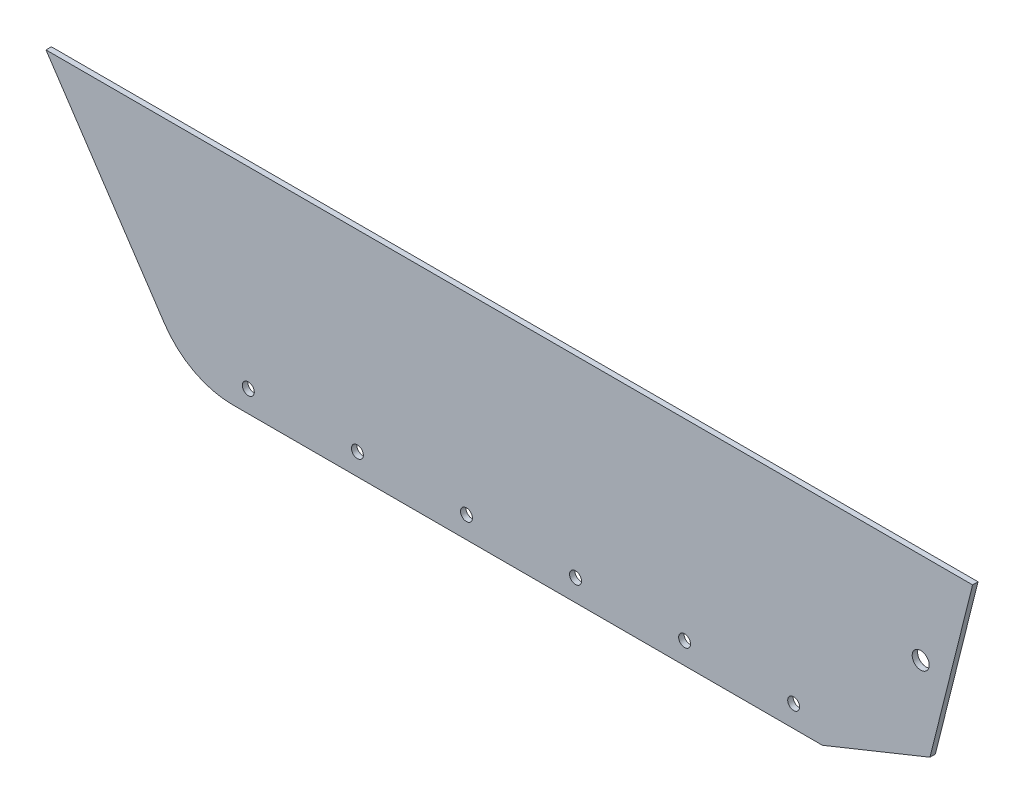
from build123d import *

# Parameters (mm, degrees)
BOSS_EXTRUDE1_DEPTH = 3.175
SKETCH1_4_R         = 3.5
CUT_EXTRUDE1_DEPTH  = 439.905857431
FILLET1_R           = 48
CUT_EXTRUDE3_DEPTH  = 10
CUT_EXTRUDE5_REACH  = 440.906
SKETCH11_R          = 5


with BuildPart() as part:
    # Sketch1 → Boss-Extrude1 (new body)
    with BuildSketch(Plane.XY):
        Polygon((-98.879411765, 3.850980392), (-31.879411765, -96.649019608), (366, -96.649019608), (403.120588235, -71.149019608), (428.120588235, 28.939617947), (-115.605170134, 28.939617947), align=None)
    extrude(amount=BOSS_EXTRUDE1_DEPTH)

    # Sketch1<4> → Cut-Extrude1 (cut, through all)
    with BuildSketch(Plane.XY):
        with Locations((3.120588235, -83.899019608)):
            Circle(SKETCH1_4_R)
        with Locations((67.120588235, -83.899019608)):
            Circle(SKETCH1_4_R)
        with Locations((131.120588235, -83.899019608)):
            Circle(SKETCH1_4_R)
        with Locations((195.120588235, -83.899019608)):
            Circle(SKETCH1_4_R)
        with Locations((259.120588235, -83.899019608)):
            Circle(SKETCH1_4_R)
        with Locations((323.120588235, -83.899019608)):
            Circle(SKETCH1_4_R)
    extrude(amount=CUT_EXTRUDE1_DEPTH, mode=Mode.SUBTRACT)

    # Fillet1
    fillet1_edges = [part.edges().sort_by_distance(p)[0] for p in [
        (-31.879411765, -96.649019608, 1.5875),
    ]]
    fillet(fillet1_edges, radius=FILLET1_R)

    # Sketch7 → Cut-Extrude3 (cut)
    with BuildSketch(Plane.XY.offset(3.175)):
        Polygon((403.120588235, -71.149019608), (340.005873473, -96.649019608), (366, -96.649019608), align=None)
    extrude(amount=-CUT_EXTRUDE3_DEPTH, mode=Mode.SUBTRACT)

    # Sketch11 → Cut-Extrude5 (cut, up to next)
    with BuildSketch(Plane(origin=(0, 0, 0), x_dir=(-1, 0, 0), z_dir=(0, 0, -1)), mode=Mode.PRIVATE) as cut_extrude5_sk1:
        with Locations((-397.678558137, -24.610405219)):
            Circle(SKETCH11_R)
    cut_extrude5_tool1 = extrude(cut_extrude5_sk1.sketch, amount=-CUT_EXTRUDE5_REACH, mode=Mode.PRIVATE) & part.part
    add(cut_extrude5_tool1.solids().sort_by_distance((397.678558, -24.610405, 0))[0], mode=Mode.SUBTRACT)


solid = part.part
